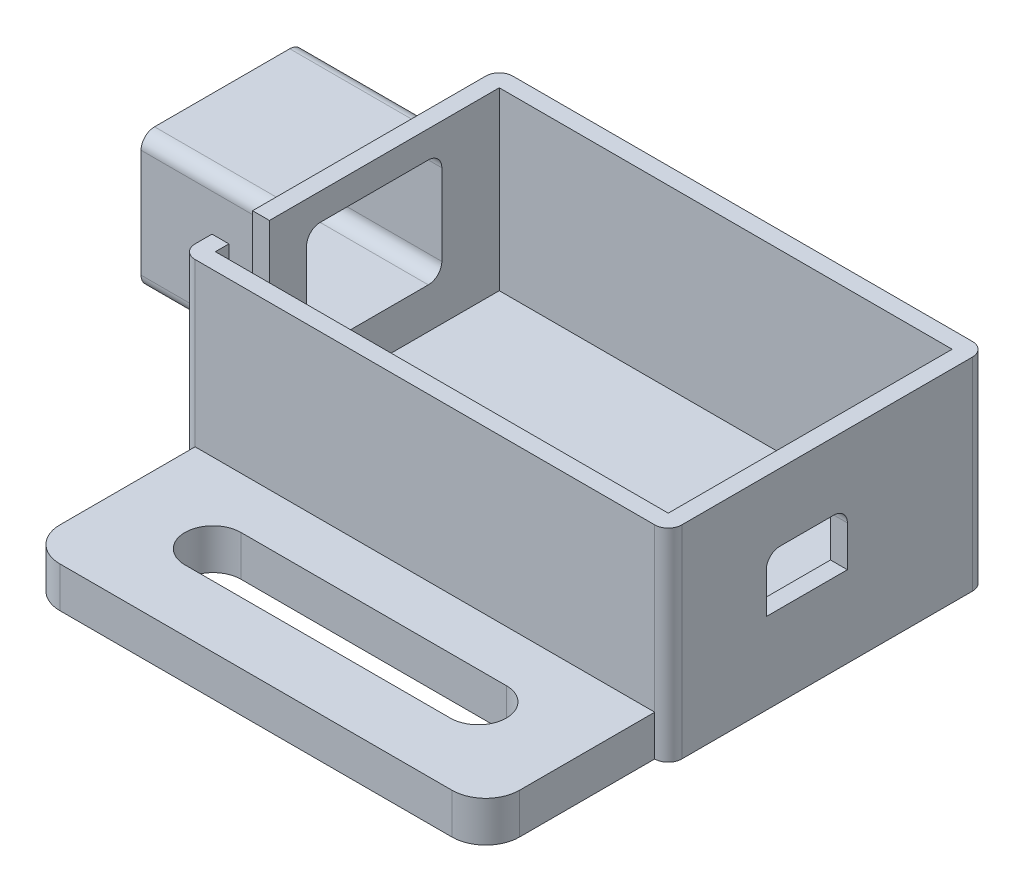
from build123d import *

# Parameters (mm, degrees)
SKETCH1_W           = 72
SKETCH1_H           = 47
BOSS_EXTRUDE1_DEPTH = 4
SKETCH3_W           = 72
SKETCH3_H           = 47
SKETCH3_W_2         = 67
SKETCH3_H_2         = 42
BOSS_EXTRUDE3_DEPTH = 26
SKETCH5_W           = 12
SKETCH5_H           = 8
CUT_EXTRUDE1_DEPTH  = 6
FILLET2_R           = 2
FILLET3_R           = 2
SKETCH11_W          = 24
SKETCH11_H          = 20
BOSS_EXTRUDE7_DEPTH = 20
SKETCH12_W          = 20
SKETCH12_H          = 16
CUT_EXTRUDE4_DEPTH  = 20
SKETCH13_W          = 15
SKETCH13_H          = 9
CUT_EXTRUDE5_DEPTH  = 20
FILLET4_R           = 2
FILLET5_R           = 2
SKETCH14_W          = 6
SKETCH14_H          = 25
CUT_EXTRUDE6_DEPTH  = 5
FILLET6_R           = 2
SKETCH15_W          = 68
SKETCH15_H          = 6
BOSS_EXTRUDE8_DEPTH = 25
FILLET7_R           = 5
CUT_EXTRUDE7_DEPTH  = 25


with BuildPart() as part:
    # Sketch1 → Boss-Extrude1 (new body)
    with BuildSketch(Plane(origin=(0, 0, 0), x_dir=(1, 0, 0), z_dir=(0, 1, 0))):
        with Locations((25.5, 13)):
            Rectangle(SKETCH1_W, SKETCH1_H)
    extrude(amount=BOSS_EXTRUDE1_DEPTH)

    # Sketch3 → Boss-Extrude3 (add)
    with BuildSketch(Plane(origin=(0, 4, 0), x_dir=(1, 0, 0), z_dir=(0, 1, 0))):
        with Locations((25.5, 13)):
            Rectangle(SKETCH3_W, SKETCH3_H)
        with Locations((25.5, 13)):
            Rectangle(SKETCH3_W_2, SKETCH3_H_2, mode=Mode.SUBTRACT)
    extrude(amount=BOSS_EXTRUDE3_DEPTH)

    # Sketch5 → Cut-Extrude1 (cut)
    with BuildSketch(Plane(origin=(61.5, 0, 0), x_dir=(0, 0, -1), z_dir=(1, 0, 0))):
        with Locations((10, 16)):
            Rectangle(SKETCH5_W, SKETCH5_H)
    extrude(amount=-CUT_EXTRUDE1_DEPTH, mode=Mode.SUBTRACT)

    # Fillet2
    fillet2_edges = [part.edges().sort_by_distance(p)[0] for p in [
        (-10.5, 15, 10.5),
        (-10.5, 15, -36.5),
        (61.5, 15, -36.5),
        (61.5, 15, 10.5),
    ]]
    fillet(fillet2_edges, radius=FILLET2_R)

    # Fillet3
    fillet3_edges = [part.edges().sort_by_distance(p)[0] for p in [
        (60.25, 20, -4),
        (60.25, 20, -16),
    ]]
    fillet(fillet3_edges, radius=FILLET3_R)

    # Sketch11 → Boss-Extrude7 (add)
    with BuildSketch(Plane.ZY.offset(10.5)):
        with Locations((-15.5, 18)):
            Rectangle(SKETCH11_W, SKETCH11_H)
    extrude(amount=BOSS_EXTRUDE7_DEPTH)

    # Sketch12 → Cut-Extrude4 (cut)
    with BuildSketch(Plane(origin=(-8, 0, 0), x_dir=(0, 0, -1), z_dir=(1, 0, 0))):
        with Locations((15.5, 18)):
            Rectangle(SKETCH12_W, SKETCH12_H)
    extrude(amount=-CUT_EXTRUDE4_DEPTH, mode=Mode.SUBTRACT)

    # Sketch13 → Cut-Extrude5 (cut)
    with BuildSketch(Plane.ZY.offset(30.5)):
        with Locations((-15.5, 18)):
            Rectangle(SKETCH13_W, SKETCH13_H)
    extrude(amount=-CUT_EXTRUDE5_DEPTH, mode=Mode.SUBTRACT)

    # Fillet4
    fillet4_edges = [part.edges().sort_by_distance(p)[0] for p in [
        (-18, 10, -25.5),
        (-18, 10, -5.5),
        (-18, 26, -5.5),
        (-18, 26, -25.5),
    ]]
    fillet(fillet4_edges, radius=FILLET4_R)

    # Fillet5
    fillet5_edges = [part.edges().sort_by_distance(p)[0] for p in [
        (-20.5, 28, -27.5),
        (-20.5, 8, -27.5),
        (-20.5, 8, -3.5),
        (-20.5, 28, -3.5),
    ]]
    fillet(fillet5_edges, radius=FILLET5_R)

    # Sketch14 → Cut-Extrude6 (cut)
    with BuildSketch(Plane.ZY.offset(10.5)):
        with Locations((3, 24.5)):
            Rectangle(SKETCH14_W, SKETCH14_H)
    extrude(amount=-CUT_EXTRUDE6_DEPTH, mode=Mode.SUBTRACT)

    # Fillet6
    fillet6_edges = [part.edges().sort_by_distance(p)[0] for p in [
        (-9.25, 12, 0),
        (-9.25, 12, 6),
    ]]
    fillet(fillet6_edges, radius=FILLET6_R)

    # Sketch15 → Boss-Extrude8 (add)
    with BuildSketch(Plane.XY.offset(10.5)):
        with Locations((25.5, 3)):
            Rectangle(SKETCH15_W, SKETCH15_H)
    extrude(amount=BOSS_EXTRUDE8_DEPTH)

    # Fillet7
    fillet7_edges = [part.edges().sort_by_distance(p)[0] for p in [
        (-8.5, 3, 35.5),
        (59.5, 3, 35.5),
    ]]
    fillet(fillet7_edges, radius=FILLET7_R)

    # Sketch16 → Cut-Extrude7 (cut)
    with BuildSketch(Plane(origin=(0, 6, 0), x_dir=(1, 0, 0), z_dir=(0, 1, 0))):
        with BuildLine():
            Line((5.870048695, -18.078882232), (45.129951305, -18.078882232))
            ThreePointArc((45.129951305, -18.078882232), (49.279951305, -22.228882232), (45.129951305, -26.378882232))
            Line((45.129951305, -26.378882232), (5.870048695, -26.378882232))
            ThreePointArc((5.870048695, -26.378882232), (1.720048695, -22.228882232), (5.870048695, -18.078882232))
        make_face()
    extrude(amount=-CUT_EXTRUDE7_DEPTH, mode=Mode.SUBTRACT)


solid = part.part
